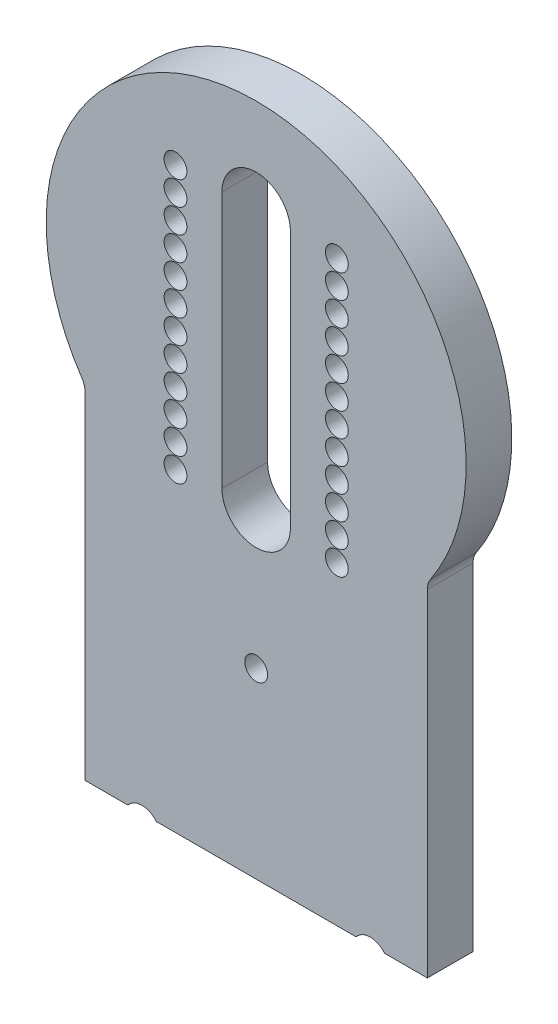
from build123d import *

# Parameters (mm, degrees)
CROQUIS1_R              = 1
SALIENTE_EXTRUIR1_DEPTH = 4
CROQUIS3_R              = 1.25
CORTAR_EXTRUIR1_DEPTH   = 4
CROQUIS4_R              = 1.6
CORTAR_EXTRUIR2_DEPTH   = 4
REDONDEO1_R             = 1.6
CROQUIS5_R              = 1
CORTAR_EXTRUIR3_DEPTH   = 4


with BuildPart() as part:
    # Croquis1 → Saliente-Extruir1 (new body)
    with BuildSketch(Plane.XY):
        with BuildLine():
            Line((-15, -10.656453444), (-15, -40.656453444))
            Line((-15, -40.656453444), (15, -40.656453444))
            Line((15, -40.656453444), (15, -10.656453444))
            ThreePointArc((15, -10.656453444), (0, 18.4), (-15, -10.656453444))
        make_face()
        with Locations((-7.07, 10)):
            Circle(CROQUIS1_R, mode=Mode.SUBTRACT)
        with Locations((7.07, 10)):
            Circle(CROQUIS1_R, mode=Mode.SUBTRACT)
        with Locations((-7.07, 7.9)):
            Circle(CROQUIS1_R, mode=Mode.SUBTRACT)
        with Locations((7.07, 7.9)):
            Circle(CROQUIS1_R, mode=Mode.SUBTRACT)
        with Locations((-7.07, 5.8)):
            Circle(CROQUIS1_R, mode=Mode.SUBTRACT)
        with Locations((7.07, 5.8)):
            Circle(CROQUIS1_R, mode=Mode.SUBTRACT)
        with Locations((-7.07, 3.7)):
            Circle(CROQUIS1_R, mode=Mode.SUBTRACT)
        with Locations((7.07, 3.7)):
            Circle(CROQUIS1_R, mode=Mode.SUBTRACT)
        with Locations((-7.07, 1.6)):
            Circle(CROQUIS1_R, mode=Mode.SUBTRACT)
        with Locations((7.07, 1.6)):
            Circle(CROQUIS1_R, mode=Mode.SUBTRACT)
        with Locations((-7.07, -0.5)):
            Circle(CROQUIS1_R, mode=Mode.SUBTRACT)
        with Locations((7.07, -0.5)):
            Circle(CROQUIS1_R, mode=Mode.SUBTRACT)
        with Locations((-7.07, -2.6)):
            Circle(CROQUIS1_R, mode=Mode.SUBTRACT)
        with Locations((7.07, -2.6)):
            Circle(CROQUIS1_R, mode=Mode.SUBTRACT)
        with Locations((-7.07, -4.7)):
            Circle(CROQUIS1_R, mode=Mode.SUBTRACT)
        with Locations((7.07, -4.7)):
            Circle(CROQUIS1_R, mode=Mode.SUBTRACT)
        with Locations((-7.07, -6.8)):
            Circle(CROQUIS1_R, mode=Mode.SUBTRACT)
        with Locations((7.07, -6.8)):
            Circle(CROQUIS1_R, mode=Mode.SUBTRACT)
        with Locations((-7.07, -8.9)):
            Circle(CROQUIS1_R, mode=Mode.SUBTRACT)
        with Locations((7.07, -8.9)):
            Circle(CROQUIS1_R, mode=Mode.SUBTRACT)
        with Locations((-7.07, -11)):
            Circle(CROQUIS1_R, mode=Mode.SUBTRACT)
        with Locations((7.07, -11)):
            Circle(CROQUIS1_R, mode=Mode.SUBTRACT)
        with Locations((-7.07, -13.1)):
            Circle(CROQUIS1_R, mode=Mode.SUBTRACT)
        with Locations((7.07, -13.1)):
            Circle(CROQUIS1_R, mode=Mode.SUBTRACT)
        with BuildLine():
            Line((3, 0), (3, 10))
            ThreePointArc((3, 10), (0, 13), (-3, 10))
            Line((-3, 10), (-3, 0))
            Line((-3, 0), (-3, -12.5))
            ThreePointArc((-3, -12.5), (0, -15.5), (3, -12.5))
            Line((3, -12.5), (3, 0))
        make_face(mode=Mode.SUBTRACT)
    extrude(amount=SALIENTE_EXTRUIR1_DEPTH)

    # Croquis3 → Cortar-Extruir1 (cut)
    with BuildSketch(Plane.XZ.offset(40.656453444)):
        with Locations(Location((-10, 2, 0), (0, 0, 270))):
            Circle(CROQUIS3_R)
        with Locations(Location((10, 2, 0), (0, 0, 90))):
            Circle(CROQUIS3_R)
    extrude(amount=-CORTAR_EXTRUIR1_DEPTH, mode=Mode.SUBTRACT)

    # Croquis4 → Cortar-Extruir2 (cut)
    with BuildSketch(Plane.XY.offset(4)):
        with Locations((10, -41.656453444)):
            Circle(CROQUIS4_R)
        with Locations((-10, -41.656453444)):
            Circle(CROQUIS4_R)
    extrude(amount=-CORTAR_EXTRUIR2_DEPTH, mode=Mode.SUBTRACT)

    # Redondeo1
    redondeo1_edges = [part.edges().sort_by_distance(p)[0] for p in [
        (15, -10.656453444, 2),
        (-15, -10.656453444, 2),
    ]]
    fillet(redondeo1_edges, radius=REDONDEO1_R)

    # Croquis5 → Cortar-Extruir3 (cut)
    with BuildSketch(Plane.XY.offset(4)):
        with Locations((0, -24.656453444)):
            Circle(CROQUIS5_R)
    extrude(amount=-CORTAR_EXTRUIR3_DEPTH, mode=Mode.SUBTRACT)


solid = part.part
